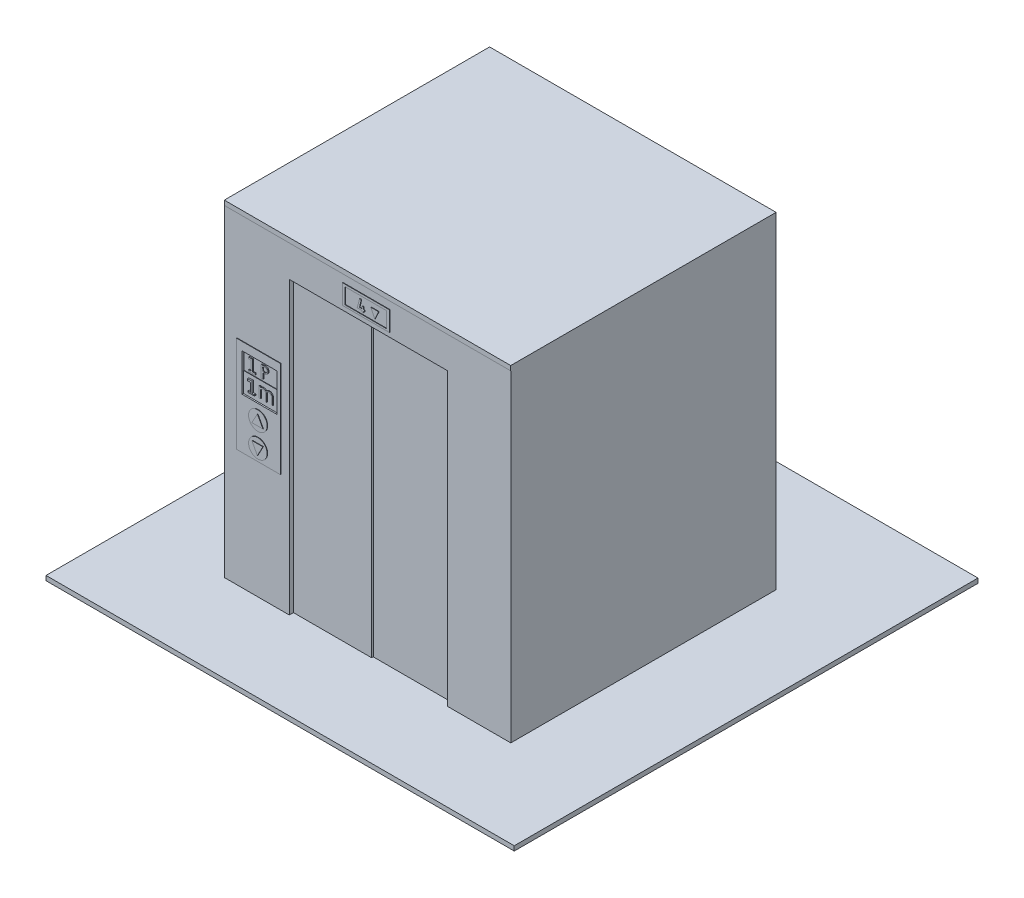
from build123d import *

# Parameters (mm, degrees)
SKETCH1_W            = 1017.150431592
SKETCH1_H            = 1007.380411388
BOSS_EXTRUDE1_DEPTH  = 10
SKETCH2_W            = 622.325209365
SKETCH2_H            = 576.276335175
SKETCH2_W_2          = 550.905616221
SKETCH2_H_2          = 495.653174758
BOSS_EXTRUDE2_DEPTH  = 700
BOSS_EXTRUDE3_DEPTH  = 10
SKETCH4_W            = 343.745663019
SKETCH4_H            = 631.457492732
CUT_EXTRUDE1_DEPTH   = 40
SKETCH5_W            = 96.085656893
SKETCH5_H            = 209.087602639
BOSS_EXTRUDE4_DEPTH  = 1
SKETCH6_W            = 75.527574186
SKETCH6_H            = 43.688329808
CUT_EXTRUDE2_DEPTH   = 1
SKETCH7_R            = 20.29708438
SKETCH7_R_2          = 20.231985555
BOSS_EXTRUDE5_DEPTH  = 1
BOSS_EXTRUDE6_DEPTH  = 1
SKETCH9_W            = 27.290112983
SKETCH9_H            = 631.457492732
BOSS_EXTRUDE7_DEPTH  = 170
SKETCH10_W           = 23.826275683
SKETCH10_H           = 630.503372623
BOSS_EXTRUDE8_DEPTH  = 170
SKETCH11_W           = 102.432085561
SKETCH11_H           = 42.683052162
BOSS_EXTRUDE9_DEPTH  = 1
SKETCH12_W           = 89.43349782
SKETCH12_H           = 33.905937228
CUT_EXTRUDE3_DEPTH   = 1
BOSS_EXTRUDE10_DEPTH = 1
BOSS_EXTRUDE11_DEPTH = 1
BOSS_EXTRUDE12_DEPTH = 1
SKETCH16_W           = 75.527574186
SKETCH16_H           = 43.688329808
CUT_EXTRUDE4_DEPTH   = 2
CUT_EXTRUDE5_DEPTH   = 1
SKETCH18_W           = 75.494640665
SKETCH18_H           = 38.009856791
CUT_EXTRUDE6_DEPTH   = 3
BOSS_EXTRUDE14_DEPTH = 2
BOSS_EXTRUDE15_DEPTH = 2


with BuildPart() as part:
    # Sketch1 → Boss-Extrude1 (new body)
    with BuildSketch(Plane(origin=(0, 0, 0), x_dir=(1, 0, 0), z_dir=(0, 1, 0))):
        Rectangle(SKETCH1_W, SKETCH1_H)
    extrude(amount=BOSS_EXTRUDE1_DEPTH)

    # Sketch2 → Boss-Extrude2 (add)
    with BuildSketch(Plane(origin=(0, 10, 0), x_dir=(1, 0, 0), z_dir=(0, 1, 0))):
        with Locations((0.175057265, -25.815388539)):
            Rectangle(SKETCH2_W, SKETCH2_H)
        with Locations((3.438260109, -29.815460152)):
            Rectangle(SKETCH2_W_2, SKETCH2_H_2, mode=Mode.SUBTRACT)
    extrude(amount=BOSS_EXTRUDE2_DEPTH)

    # Sketch3 → Boss-Extrude3 (add)
    with BuildSketch(Plane(origin=(0, 710, 0), x_dir=(1, 0, 0), z_dir=(0, 1, 0))):
        Polygon((-310.987547417, 262.322779049), (311.337661948, 262.322779049), (311.337661948, -314.105065769), (-310.987547417, -313.953556126), align=None)
    extrude(amount=BOSS_EXTRUDE3_DEPTH)

    # Sketch4 → Cut-Extrude1 (cut)
    with BuildSketch(Plane.XY.offset(313.953556126)):
        with Locations((1.971257292, 325.728746366)):
            Rectangle(SKETCH4_W, SKETCH4_H)
    extrude(amount=-CUT_EXTRUDE1_DEPTH, mode=Mode.SUBTRACT)

    # Sketch5 → Boss-Extrude4 (add)
    with BuildSketch(Plane.XY.offset(313.953556126)):
        with Locations((-235.628465158, 369.989290471)):
            Rectangle(SKETCH5_W, SKETCH5_H)
    extrude(amount=BOSS_EXTRUDE4_DEPTH)

    # Sketch6 → Cut-Extrude2 (cut)
    with BuildSketch(Plane.XY.offset(314.953556126)):
        with Locations((-233.410831007, 396.905866965)):
            Rectangle(SKETCH6_W, SKETCH6_H)
    extrude(amount=-CUT_EXTRUDE2_DEPTH, mode=Mode.SUBTRACT)

    # Sketch7 → Boss-Extrude5 (add)
    with BuildSketch(Plane.XY.offset(314.953556126)):
        with Locations((-236.075713016, 343.617219623)):
            Circle(SKETCH7_R)
        with Locations((-236.075713016, 291.501520139)):
            Circle(SKETCH7_R_2)
    extrude(amount=BOSS_EXTRUDE5_DEPTH)

    # Sketch8 → Boss-Extrude6 (add)
    with BuildSketch(Plane.XY.offset(315.953556126)):
        Polygon((-248.100542069, 334.343180385), (-224.116847865, 334.343180385), (-236.108694967, 356.570085863), align=None)
        Polygon((-248.100542069, 300.734143469), (-224.116847865, 300.734143469), (-236.108694967, 278.021129489), align=None)
    extrude(amount=BOSS_EXTRUDE6_DEPTH)

    # Sketch9 → Boss-Extrude7 (add)
    with BuildSketch(Plane(origin=(-169.901574217, 0, 0), x_dir=(0, 0, -1), z_dir=(1, 0, 0))):
        with Locations((-291.287104022, 325.728746366)):
            Rectangle(SKETCH9_W, SKETCH9_H)
    extrude(amount=BOSS_EXTRUDE7_DEPTH)

    # Sketch10 → Boss-Extrude8 (add)
    with BuildSketch(Plane(origin=(0.098425783, 0, 0), x_dir=(0, 0, -1), z_dir=(1, 0, 0))):
        with Locations((-289.555185372, 325.251686312)):
            Rectangle(SKETCH10_W, SKETCH10_H)
    extrude(amount=BOSS_EXTRUDE8_DEPTH)

    # Sketch11 → Boss-Extrude9 (add)
    with BuildSketch(Plane.XY.offset(313.953556126)):
        with Locations((-2.491684156, 672.586316149)):
            Rectangle(SKETCH11_W, SKETCH11_H)
    extrude(amount=BOSS_EXTRUDE9_DEPTH)

    # Sketch12 → Cut-Extrude3 (cut)
    with BuildSketch(Plane.XY.offset(314.953556126)):
        with Locations((-2.82995258, 672.168915251)):
            Rectangle(SKETCH12_W, SKETCH12_H)
    extrude(amount=-CUT_EXTRUDE3_DEPTH, mode=Mode.SUBTRACT)

    # Sketch13 → Boss-Extrude10 (add)
    with BuildSketch(Plane.XY.offset(313.953556126)):
        Polygon((-16.188659158, 682.333537789), (-12.363636267, 682.333537789), (-16.280886962, 666.180161515), (-10.826136902, 666.180161515), (-10.826136902, 671.523280071), (-7.909927509, 671.523280071), (-7.909927509, 666.180161515), (-5.371386842, 666.180161515), (-5.371386842, 662.797245592), (-7.909927509, 662.797245592), (-7.909927509, 659.936990738), (-10.826136902, 659.936990738), (-10.826136902, 662.797245592), (-21.28940391, 662.797245592), align=None)
    extrude(amount=BOSS_EXTRUDE10_DEPTH)

    # Sketch14 → Boss-Extrude11 (add)
    with BuildSketch(Plane.XY.offset(313.953556126)):
        Polygon((8.28251296, 678.526064939), (25.453577984, 678.526064939), (16.868045472, 660.40217423), align=None)
    extrude(amount=BOSS_EXTRUDE11_DEPTH)

    # Sketch15 → Boss-Extrude12 (add)
    with BuildSketch(Plane.XY.offset(313.953556126)):
        Polygon((-253.392365097, 406.408287302), (-253.392365097, 387.565087067), (-258.932297981, 387.565087067), (-258.932297981, 385.030446751), (-244.376138332, 385.030446751), (-244.376138332, 387.568096861), (-249.880180429, 387.568096861), (-249.880180429, 410.563051887), (-259.692933011, 410.252172121), (-259.566620724, 406.408287302), align=None)
    extrude(amount=BOSS_EXTRUDE12_DEPTH)

    # Sketch16 → Cut-Extrude4 (cut)
    with BuildSketch(Plane.XY.offset(313.953556126)):
        with Locations((-233.410831007, 396.905866965)):
            Rectangle(SKETCH16_W, SKETCH16_H)
        Polygon((-258.932297981, 387.565087067), (-253.392365097, 387.565087067), (-253.392365097, 406.408287302), (-259.566620724, 406.408287302), (-259.692933011, 410.252172121), (-249.880180429, 410.563051887), (-249.880180429, 387.568096861), (-244.376138332, 387.568096861), (-244.376138332, 385.030446751), (-258.932297981, 385.030446751), align=None, mode=Mode.SUBTRACT)
        with BuildLine():
            Line((-235.648545177, 385.585769087), (-235.648545177, 408.465773981))
            Line((-235.648545177, 408.465773981), (-231.895053527, 408.465773981))
            Line((-231.895053527, 408.465773981), (-231.895053527, 406.607783771))
            ThreePointArc((-231.895053527, 406.607783771), (-226.013052079, 408.340663022), (-220.604725505, 405.450885314))
            ThreePointArc((-220.604725505, 405.450885314), (-212.450287881, 408.121471894), (-206.512581436, 401.927077024))
            Line((-206.512581436, 401.927077024), (-206.270978925, 385.585769087))
            Line((-206.270978925, 385.585769087), (-208.886279481, 385.585769087))
            Line((-208.886279481, 385.585769087), (-208.886279481, 401.591739947))
            ThreePointArc((-208.886279481, 401.591739947), (-213.544522639, 405.905815865), (-219.282803566, 403.188719557))
            Line((-219.282803566, 403.188719557), (-219.086260967, 397.970062451))
            Line((-219.086260967, 397.970062451), (-218.821188952, 385.585769087))
            Line((-218.821188952, 385.585769087), (-221.983422689, 385.585769087))
            Line((-221.983422689, 385.585769087), (-221.983422689, 403.056833873))
            ThreePointArc((-221.983422689, 403.056833873), (-227.433038153, 405.693579889), (-232.223072214, 401.991376226))
            Line((-232.223072214, 401.991376226), (-232.106265572, 385.585769087))
            Line((-232.106265572, 385.585769087), (-235.648545177, 385.585769087))
        make_face(mode=Mode.SUBTRACT)
    extrude(amount=-CUT_EXTRUDE4_DEPTH, mode=Mode.SUBTRACT)

    # Sketch17 → Cut-Extrude5 (cut)
    with BuildSketch(Plane.XY.offset(311.953556126)):
        Polygon((-271.209439503, 458.857228745), (-195.647043914, 458.857228745), (-195.704078741, 418.44137546), (-271.209439503, 418.44137546), align=None)
    extrude(amount=-CUT_EXTRUDE5_DEPTH, mode=Mode.SUBTRACT)

    # Sketch18 → Cut-Extrude6 (cut)
    with BuildSketch(Plane.XY.offset(314.953556126)):
        with Locations((-233.394364247, 437.754960265)):
            Rectangle(SKETCH18_W, SKETCH18_H)
    extrude(amount=-CUT_EXTRUDE6_DEPTH, mode=Mode.SUBTRACT)

    # Sketch19 → Boss-Extrude14 (add)
    with BuildSketch(Plane.XY.offset(310.953556126)):
        Polygon((-254.312852224, 446.740647117), (-254.312852224, 426.35566573), (-259.396180858, 426.35566573), (-259.396180858, 423.275008449), (-244.678284124, 423.275008449), (-244.678284124, 426.345347073), (-250.728067912, 426.345347073), (-250.728067912, 450.11543046), (-259.396180858, 450.11543046), (-259.396180858, 446.740647117), align=None)
    extrude(amount=BOSS_EXTRUDE14_DEPTH)

    # Sketch20 → Boss-Extrude15 (add)
    with BuildSketch(Plane.XY.offset(310.953556126)):
        with BuildLine():
            Line((-231.738910846, 449.836701393), (-231.738910846, 423.361516406))
            Line((-231.738910846, 423.361516406), (-228.297984767, 423.361516406))
            Line((-228.297984767, 423.361516406), (-228.145561752, 436.327846212))
            ThreePointArc((-228.145561752, 436.327846212), (-216.928259639, 443.252630869), (-228.56606882, 449.444715067))
            Line((-228.56606882, 449.444715067), (-228.61564163, 450.293665645))
            Line((-228.61564163, 450.293665645), (-231.738910846, 450.293665645))
            Line((-231.738910846, 450.293665645), (-231.738910846, 449.836701393))
        make_face()
        with BuildLine():
            Line((-228.56606882, 446.492870427), (-228.297984767, 439.236609845))
            ThreePointArc((-228.297984767, 439.236609845), (-219.191503534, 443.206133185), (-228.56606882, 446.492870427))
        make_face(mode=Mode.SUBTRACT)
    extrude(amount=BOSS_EXTRUDE15_DEPTH)


solid = part.part
